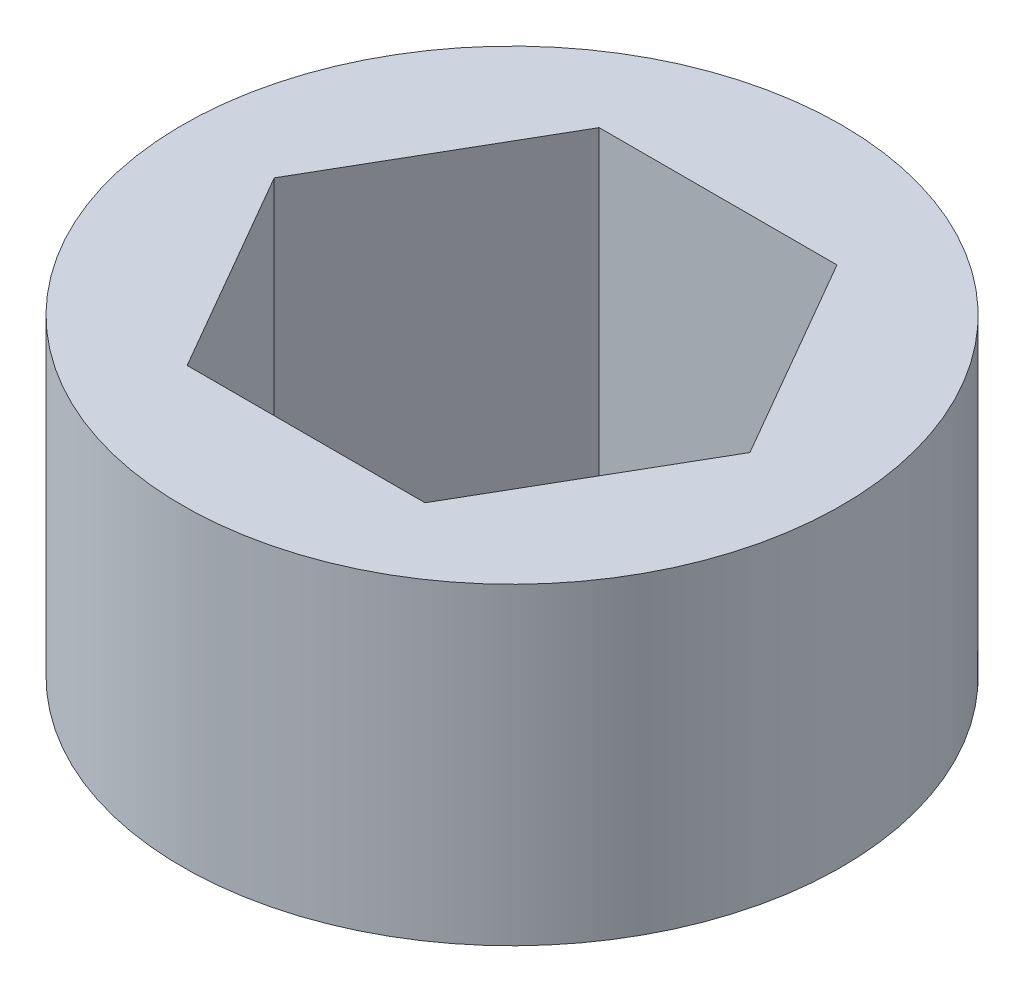
from build123d import *

# Parameters (mm, degrees)
SKETCH1_R           = 4
BOSS_EXTRUDE1_DEPTH = 3.8


with BuildPart() as part:
    # Sketch1 → Boss-Extrude1 (new body)
    with BuildSketch(Plane(origin=(0, 0, 0), x_dir=(1, 0, 0), z_dir=(0, 1, 0))):
        with Locations(Location((0, 0, 0), (0, 0, 90))):
            Circle(SKETCH1_R)
        Polygon((2.886751346, 0), (1.443375673, 2.5), (-1.443375673, 2.5), (-2.886751346, 0), (-1.443375673, -2.5), (1.443375673, -2.5), align=None, mode=Mode.SUBTRACT)
    extrude(amount=BOSS_EXTRUDE1_DEPTH)


solid = part.part
